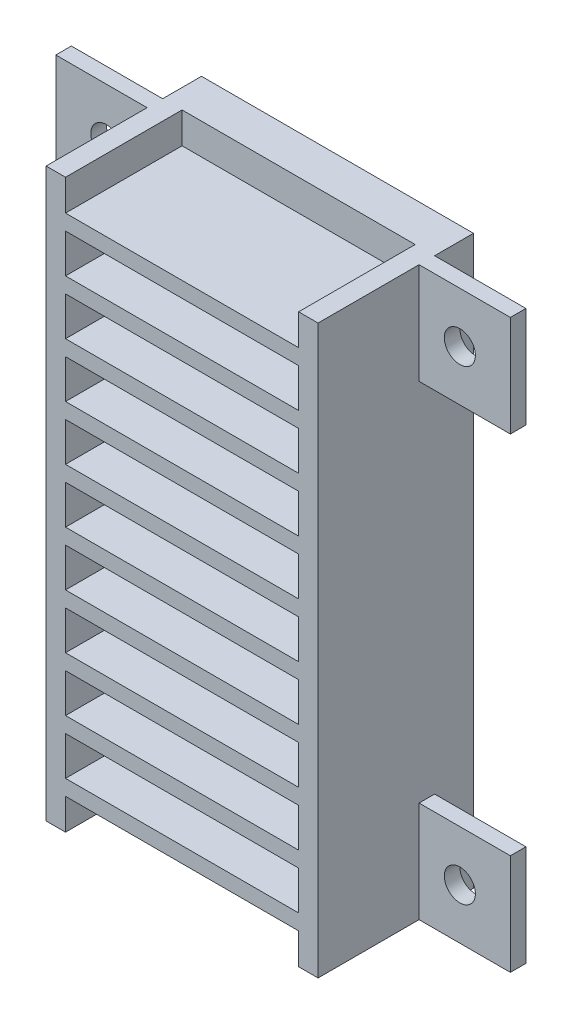
from build123d import *

# Parameters (mm, degrees)
SKETCH1_W           = 35
SKETCH1_H           = 73
SKETCH1_W_2         = 30
SKETCH1_H_2         = 5
BOSS_EXTRUDE1_DEPTH = 5
SKETCH2_W           = 2
SKETCH2_H           = 2
BOSS_EXTRUDE2_DEPTH = 4.1
SKETCH4_W           = 13
SKETCH4_H           = 13
SKETCH4_R           = 2
BOSS_EXTRUDE3_DEPTH = 2
SKETCH7_W           = 30
SKETCH7_H           = 5
BOSS_EXTRUDE4_DEPTH = 20


with BuildPart() as part:
    # Sketch1 → Boss-Extrude1 (new body)
    with BuildSketch(Plane.XY):
        with Locations((0, 36.5)):
            Rectangle(SKETCH1_W, SKETCH1_H)
        with Locations((0, 64.5)):
            Rectangle(SKETCH1_W_2, SKETCH1_H_2, mode=Mode.SUBTRACT)
        with Locations((0, 57.5)):
            Rectangle(SKETCH1_W_2, SKETCH1_H_2, mode=Mode.SUBTRACT)
        with Locations((0, 50.5)):
            Rectangle(SKETCH1_W_2, SKETCH1_H_2, mode=Mode.SUBTRACT)
        with Locations((0, 43.5)):
            Rectangle(SKETCH1_W_2, SKETCH1_H_2, mode=Mode.SUBTRACT)
        with Locations((0, 36.5)):
            Rectangle(SKETCH1_W_2, SKETCH1_H_2, mode=Mode.SUBTRACT)
        with Locations((0, 29.5)):
            Rectangle(SKETCH1_W_2, SKETCH1_H_2, mode=Mode.SUBTRACT)
        with Locations((0, 22.5)):
            Rectangle(SKETCH1_W_2, SKETCH1_H_2, mode=Mode.SUBTRACT)
        with Locations((0, 15.5)):
            Rectangle(SKETCH1_W_2, SKETCH1_H_2, mode=Mode.SUBTRACT)
        with Locations((0, 8.5)):
            Rectangle(SKETCH1_W_2, SKETCH1_H_2, mode=Mode.SUBTRACT)
    extrude(amount=BOSS_EXTRUDE1_DEPTH)

    # Sketch2 → Boss-Extrude2 (add)
    with BuildSketch(Plane(origin=(0, 0, 0), x_dir=(-1, 0, 0), z_dir=(0, 0, -1))):
        with Locations((-3.05, 40)):
            Rectangle(SKETCH2_W, SKETCH2_H)
        with Locations((3.05, 40)):
            Rectangle(SKETCH2_W, SKETCH2_H)
        with Locations((-3.05, 54)):
            Rectangle(SKETCH2_W, SKETCH2_H)
        with Locations((3.05, 54)):
            Rectangle(SKETCH2_W, SKETCH2_H)
        with Locations((-3.05, 26)):
            Rectangle(SKETCH2_W, SKETCH2_H)
        with Locations((3.05, 26)):
            Rectangle(SKETCH2_W, SKETCH2_H)
        with Locations((-3.05, 12)):
            Rectangle(SKETCH2_W, SKETCH2_H)
        with Locations((3.05, 12)):
            Rectangle(SKETCH2_W, SKETCH2_H)
    extrude(amount=BOSS_EXTRUDE2_DEPTH)

    # Sketch4 → Boss-Extrude3 (add)
    # profile 1 of 4: a face of its own
    with BuildSketch(Plane.XY.offset(5)):
        with Locations((-22.75, 66.5)):
            Rectangle(SKETCH4_W, SKETCH4_H)
        with Locations((-22.75, 66.5)):
            Circle(SKETCH4_R, mode=Mode.SUBTRACT)
    # profile 2 of 4: a face of its own
    with BuildSketch(Plane.XY.offset(5)):
        with Locations((-22.75, 6.5)):
            Rectangle(SKETCH4_W, SKETCH4_H)
        with Locations(Location((-22.75, 6.5, 0), (0, 0, 180))):
            Circle(SKETCH4_R, mode=Mode.SUBTRACT)
    # profile 3 of 4: a face of its own
    with BuildSketch(Plane.XY.offset(5)):
        with Locations((22.75, 66.5)):
            Rectangle(SKETCH4_W, SKETCH4_H)
        with Locations(Location((22.75, 66.5, 0), (0, 0, 180))):
            Circle(SKETCH4_R, mode=Mode.SUBTRACT)
    # profile 4 of 4: a face of its own
    with BuildSketch(Plane.XY.offset(5)):
        with Locations((22.75, 6.5)):
            Rectangle(SKETCH4_W, SKETCH4_H)
        with Locations((22.75, 6.5)):
            Circle(SKETCH4_R, mode=Mode.SUBTRACT)
    extrude(amount=BOSS_EXTRUDE3_DEPTH)

    # Sketch7 → Boss-Extrude4 (add)
    with BuildSketch(Plane.XY):
        Polygon((-15, 69), (-15, 73), (-17.5, 73), (-17.5, 0), (-15, 0), (-15, 4), (15, 4), (15, 0), (17.5, 0), (17.5, 73), (15, 73), (15, 69), align=None)
        with Locations((0, 64.5)):
            Rectangle(SKETCH7_W, SKETCH7_H, mode=Mode.SUBTRACT)
        with Locations((0, 8.5)):
            Rectangle(SKETCH7_W, SKETCH7_H, mode=Mode.SUBTRACT)
        with Locations((0, 15.5)):
            Rectangle(SKETCH7_W, SKETCH7_H, mode=Mode.SUBTRACT)
        with Locations((0, 22.5)):
            Rectangle(SKETCH7_W, SKETCH7_H, mode=Mode.SUBTRACT)
        with Locations((0, 29.5)):
            Rectangle(SKETCH7_W, SKETCH7_H, mode=Mode.SUBTRACT)
        with Locations((0, 36.5)):
            Rectangle(SKETCH7_W, SKETCH7_H, mode=Mode.SUBTRACT)
        with Locations((0, 43.5)):
            Rectangle(SKETCH7_W, SKETCH7_H, mode=Mode.SUBTRACT)
        with Locations((0, 50.5)):
            Rectangle(SKETCH7_W, SKETCH7_H, mode=Mode.SUBTRACT)
        with Locations((0, 57.5)):
            Rectangle(SKETCH7_W, SKETCH7_H, mode=Mode.SUBTRACT)
    extrude(amount=BOSS_EXTRUDE4_DEPTH)


solid = part.part
